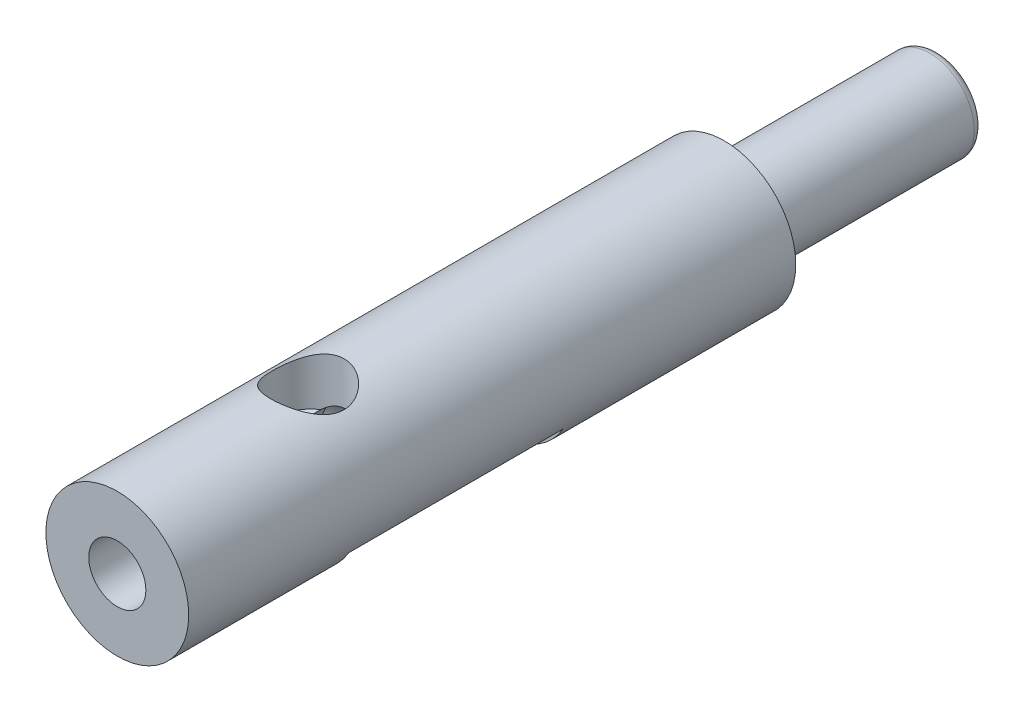
from build123d import *

# Parameters (mm, degrees)
SKETCH1_R                      = 2.5
BOSS_EXTRUDE1_DEPTH            = 12
SKETCH2_R                      = 4
BOSS_EXTRUDE2_DEPTH            = 34
F_3_2_3_2_DIAMETER_HOLE1_D     = 3.2
F_3_2_3_2_DIAMETER_HOLE1_DEPTH = 13.03862301
F_3_2_3_2_DIAMETER_HOLE1_TIP   = 0.96137699
CUT_EXTRUDE1_DEPTH             = 35.467375879
CUT_EXTRUDE1_DEPTH_BACK        = 35.467375879
SKETCH6_W                      = 12
SKETCH6_H                      = 2
F_4_0_4_DIAMETER_HOLE3_D       = 4
F_4_0_4_DIAMETER_HOLE3_DEPTH   = 2.798278762
F_4_0_4_DIAMETER_HOLE3_TIP     = 1.201721238
FILLET1_R                      = 0.5


with BuildPart() as part:
    # Sketch1 → Boss-Extrude1 (new body)
    with BuildSketch(Plane.XY):
        Circle(SKETCH1_R)
    extrude(amount=-BOSS_EXTRUDE1_DEPTH)

    # Sketch2 → Boss-Extrude2 (add)
    with BuildSketch(Plane.XY):
        Circle(SKETCH2_R)
    extrude(amount=BOSS_EXTRUDE2_DEPTH)

    # Ø3.2 (3.2) Diameter Hole1
    with Locations(Plane.XY.offset(34)):
        with Locations((0, 0)):
            Hole(F_3_2_3_2_DIAMETER_HOLE1_D / 2, depth=F_3_2_3_2_DIAMETER_HOLE1_DEPTH)
            with Locations((0, 0, -(F_3_2_3_2_DIAMETER_HOLE1_DEPTH + F_3_2_3_2_DIAMETER_HOLE1_TIP / 2))):  # 118° drill point
                Cone(0, F_3_2_3_2_DIAMETER_HOLE1_D / 2, F_3_2_3_2_DIAMETER_HOLE1_TIP, mode=Mode.SUBTRACT)

    # Sketch6 → Cut-Extrude1 (cut, two sides: drawn at the far end of the back side and taken through both)
    with BuildSketch(Plane(origin=(0, 0, 0), x_dir=(0, 0, -1), z_dir=(1, 0, 0)).offset(-CUT_EXTRUDE1_DEPTH_BACK)):
        with Locations((-18.5, -3)):
            Rectangle(SKETCH6_W, SKETCH6_H)
    extrude(amount=CUT_EXTRUDE1_DEPTH + CUT_EXTRUDE1_DEPTH_BACK, mode=Mode.SUBTRACT)

    # Ø4.0 (4) Diameter Hole3
    with Locations(Plane(origin=(-0.101557348, 3.998710555, 23.218070674), x_dir=(0.999677638825, 0.025389337009, 0), z_dir=(-0.025389337009, 0.999677638825, 0))):
        with Locations((0, 0)):
            Hole(F_4_0_4_DIAMETER_HOLE3_D / 2, depth=F_4_0_4_DIAMETER_HOLE3_DEPTH)
            with Locations((0, 0, -(F_4_0_4_DIAMETER_HOLE3_DEPTH + F_4_0_4_DIAMETER_HOLE3_TIP / 2))):  # 118° drill point
                Cone(0, F_4_0_4_DIAMETER_HOLE3_D / 2, F_4_0_4_DIAMETER_HOLE3_TIP, mode=Mode.SUBTRACT)

    # Fillet1
    fillet1_edges = [part.edges().sort_by_distance(p)[0] for p in [
        (-2.5, 0, -12),
    ]]
    fillet(fillet1_edges, radius=FILLET1_R)


solid = part.part
